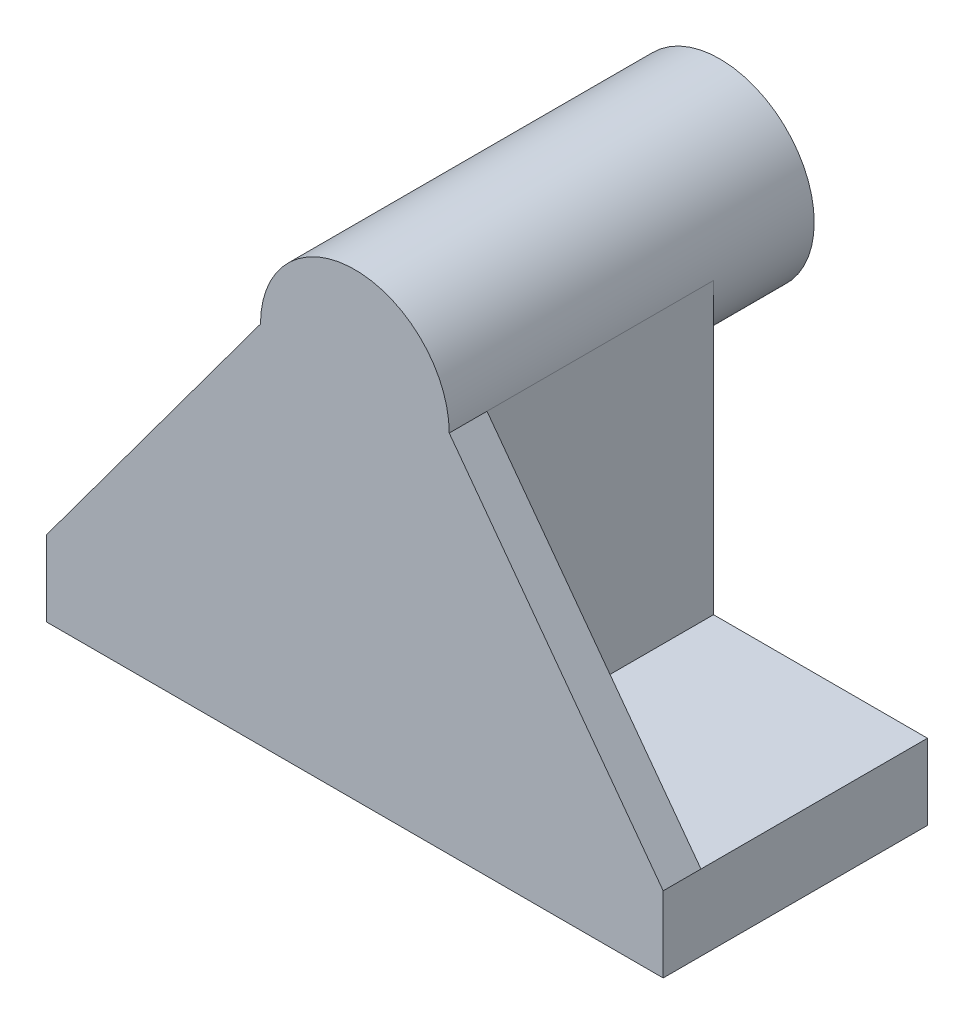
from build123d import *

# Parameters (mm, degrees)
MAIN_BODY_DEPTH = 10.5
RIB1_REACH      = 45.385
SKETCH2_WALL_W  = 117.37050971
SKETCH2_WALL_H  = 3
SKETCH3_R       = 7.5
SHAFT_DEPTH     = 8


with BuildPart() as part:
    # Sketch1 → Main Body (new, symmetric)
    with BuildSketch(Plane.XY):
        with BuildLine():
            Line((-7.5, 0), (-7.5, -29))
            Line((-7.5, -29), (24.5, -29))
            Line((24.5, -29), (24.5, -23))
            Line((24.5, -23), (7.5, -23))
            Line((7.5, -23), (7.5, 0))
            ThreePointArc((7.5, 0), (0, 7.5), (-7.5, 0))
        make_face()
    main_body = extrude(amount=MAIN_BODY_DEPTH, both=True)

    # Sketch2 wall → Rib1 (add, up to next)
    with BuildSketch(Plane(origin=(16, -11.5, 10.5), x_dir=(0.594391061084, -0.804176141466, 0), z_dir=(0.804176141466, 0.594391061084, 0)), mode=Mode.PRIVATE) as rib1_sk1:
        with Locations((0, 1.5)):
            Rectangle(SKETCH2_WALL_W, SKETCH2_WALL_H)
    rib1_tool1 = extrude(rib1_sk1.sketch, amount=-RIB1_REACH, mode=Mode.PRIVATE) - part.part
    rib1 = rib1_tool1.solids().sort_by_distance((16, -11.5, 10.5))[0]
    add(rib1)

    # Sketch3 → Shaft (add)
    with BuildSketch(Plane.XY.offset(-10.5)):
        Circle(SKETCH3_R)
    extrude(amount=-SHAFT_DEPTH)

    # Mirror2: Main Body, Rib1 across plane
    add(main_body.mirror(Plane(origin=(0, 0, 0), x_dir=(0, 0, 1), z_dir=(1, 0, 0))))
    add(rib1.mirror(Plane(origin=(0, 0, 0), x_dir=(0, 0, 1), z_dir=(1, 0, 0))))


solid = part.part
